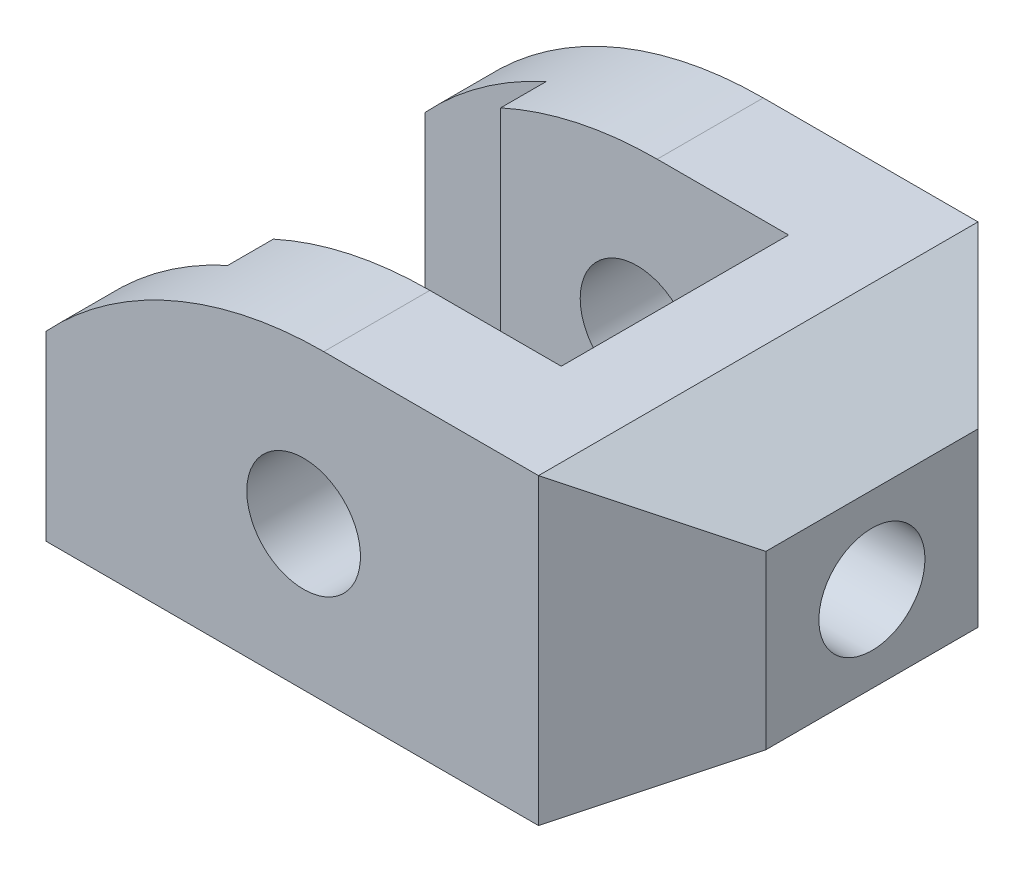
from build123d import *

# Parameters (mm, degrees)
SKETCH1_R           = 7.5
BOSS_EXTRUDE1_DEPTH = 29
CUT_EXTRUDE1_DEPTH  = 72
CUT_EXTRUDE2_DEPTH  = 72
SKETCH4_R           = 7
CUT_EXTRUDE3_DEPTH  = 72


with BuildPart() as part:
    # Sketch1 → Boss-Extrude1 (new, symmetric)
    with BuildSketch(Plane.XY):
        with BuildLine():
            Line((0, 0), (65, 0))
            Line((65, 0), (80, 8.660254038))
            Line((80, 8.660254038), (80, 31.339745962))
            Line((80, 31.339745962), (65, 40))
            Line((65, 40), (36.66060556, 40))
            ThreePointArc((36.66060556, 40), (16.66060556, 35.82575695), (0, 24))
            Line((0, 24), (0, 0))
        make_face()
        with Locations(Location((34, 19, 0), (0, 0, 180))):
            Circle(SKETCH1_R, mode=Mode.SUBTRACT)
    extrude(amount=BOSS_EXTRUDE1_DEPTH, both=True)

    # Sketch2 → Cut-Extrude1 (cut)
    with BuildSketch(Plane(origin=(0, 0, 0), x_dir=(1, 0, 0), z_dir=(0, 1, 0))):
        Polygon((0, 21), (16, 21), (16, 15), (54, 15), (54, -15), (16, -15), (16, -21), (0, -21), align=None)
    extrude(amount=CUT_EXTRUDE1_DEPTH, mode=Mode.SUBTRACT)

    # Sketch3 → Cut-Extrude2 (cut)
    with BuildSketch(Plane(origin=(0, 0, 0), x_dir=(1, 0, 0), z_dir=(0, 1, 0))):
        Polygon((80, 29), (65, 29), (80, 14), align=None)
        Polygon((65, -29), (80, -29), (80, -14), align=None)
    extrude(amount=CUT_EXTRUDE2_DEPTH, mode=Mode.SUBTRACT)

    # Sketch4 → Cut-Extrude3 (cut)
    with BuildSketch(Plane(origin=(80, 0, 0), x_dir=(0, 0, -1), z_dir=(1, 0, 0))):
        with Locations((0, 20)):
            Circle(SKETCH4_R)
    extrude(amount=-CUT_EXTRUDE3_DEPTH, mode=Mode.SUBTRACT)


solid = part.part
